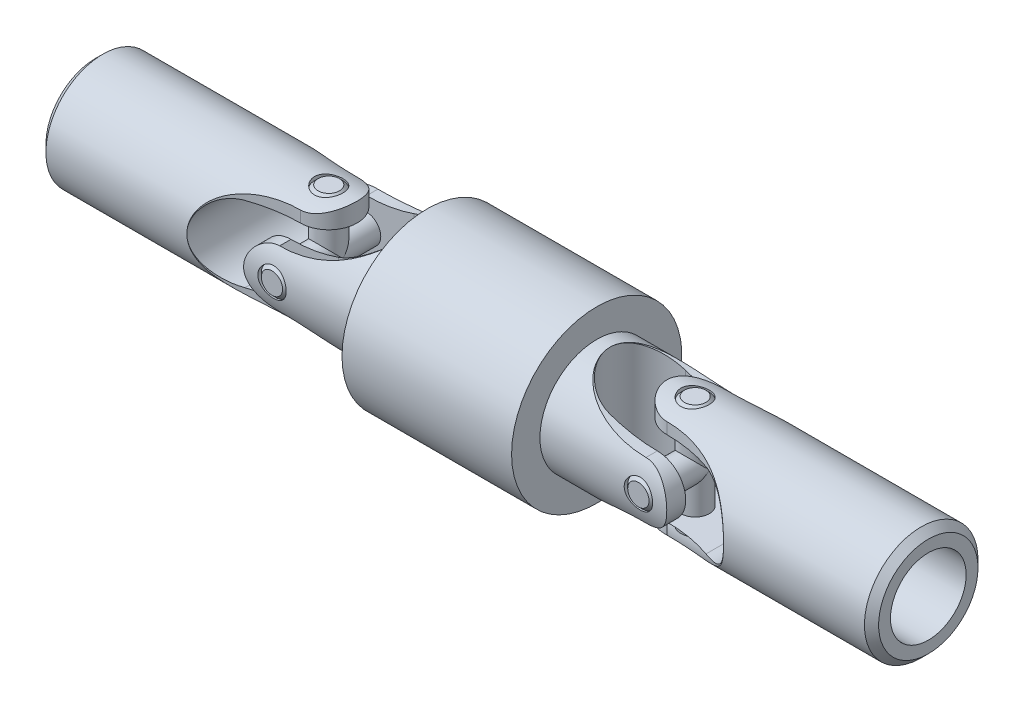
from build123d import *

# Parameters (mm, degrees)
SKETCH1_W             = 21.93925
SKETCH1_H             = 4.7625
CHAMFER1_SIZE         = 0.595313
EXTRUDE1_DEPTH        = 19.716349
EXTRUDE1_DEPTH_BACK   = 19.716349
EXTRUDE3_DEPTH        = 19.716349
EXTRUDE3_DEPTH_BACK   = 19.716349
SKETCH4_R             = 3.175
EXTRUDE4_DEPTH        = 9.525
EXTRUDE6_DEPTH        = 19.716349
EXTRUDE6_DEPTH_BACK   = 19.716349
SKETCH6_R             = 1.190625
BODY_MOVE_COPY1_ANGLE = 90
SKETCH19_W            = 4.191
SKETCH19_H            = 9.525
CUT_EXTRUDE1_DEPTH    = 38.1
SKETCH14_R            = 1.190625
EXTRUDE14_DEPTH       = 4.7625
SKETCH16_R            = 1.190625
EXTRUDE16_DEPTH       = 4.7625
CHAMFER3_SIZE         = 0.297656
SKETCH20_R            = 7.14375
SKETCH20_R_2          = 4.7625
BOSS_EXTRUDE1_DEPTH   = 7.112


with BuildPart() as part:
    # Sketch1 → Revolve1 (revolve)
    with BuildSketch(Plane(origin=(0, 0, 0), x_dir=(1, 0, 0), z_dir=(0, 1, 0)), mode=Mode.PRIVATE) as revolve1_sk:
        with Locations((-6.492875, 2.38125)):
            Rectangle(SKETCH1_W, SKETCH1_H)
    revolve(revolve1_sk.sketch.rotate(Axis((-17.4625, 0, 0), (1, 0, 0)), 180), axis=Axis((-17.4625, 0, 0), (1, 0, 0)))

    # Chamfer1
    chamfer1_edges = [part.edges().sort_by_distance(p)[0] for p in [
        (-17.4625, 0, -4.7625),
    ]]
    chamfer(chamfer1_edges, length=CHAMFER1_SIZE)

    # Sketch2 → Extrude1 (cut, two sides: drawn at the far end of the back side and taken through both)
    with BuildSketch(Plane(origin=(0, 0, 0), x_dir=(1, 0, 0), z_dir=(0, 1, 0)).offset(-EXTRUDE1_DEPTH_BACK)):
        with BuildLine():
            Line((-5.04825, 4.7625), (6.858, 4.7625))
            Line((6.858, 4.7625), (6.858, -4.7625))
            Line((6.858, -4.7625), (-5.04825, -4.7625))
            ThreePointArc((-5.04825, -4.7625), (-1.669587, -2.992239), (2.0955, -2.38125))
            ThreePointArc((2.0955, -2.38125), (4.47675, 0), (2.0955, 2.38125))
            ThreePointArc((2.0955, 2.38125), (-1.669587, 2.992239), (-5.04825, 4.7625))
        make_face()
    extrude(amount=EXTRUDE1_DEPTH + EXTRUDE1_DEPTH_BACK, mode=Mode.SUBTRACT)

    # Sketch3 → Extrude3 (cut, two sides: drawn at the far end of the back side and taken through both)
    with BuildSketch(Plane.XY.offset(-EXTRUDE3_DEPTH_BACK)):
        with BuildLine():
            Line((-1.876425, 3.171825), (6.858, 3.171825))
            Line((6.858, 3.171825), (6.858, -3.171825))
            Line((6.858, -3.171825), (-1.876425, -3.171825))
            ThreePointArc((-1.876425, -3.171825), (-5.04825, 0), (-1.876425, 3.171825))
        make_face()
    extrude(amount=EXTRUDE3_DEPTH + EXTRUDE3_DEPTH_BACK, mode=Mode.SUBTRACT)

    # Sketch4 → Extrude4 (cut)
    with BuildSketch(Plane.ZY.offset(17.4625)):
        Circle(SKETCH4_R)
    extrude(amount=-EXTRUDE4_DEPTH, mode=Mode.SUBTRACT)

    # Sketch6 → Extrude6 (cut, two sides: drawn at the far end of the back side and taken through both)
    with BuildSketch(Plane(origin=(0, 0, 0), x_dir=(1, 0, 0), z_dir=(0, 1, 0)).offset(-EXTRUDE6_DEPTH_BACK)):
        with Locations(Location((2.0955, 0, 0), (0, 0, 270))):
            Circle(SKETCH6_R)
    extrude(amount=EXTRUDE6_DEPTH + EXTRUDE6_DEPTH_BACK, mode=Mode.SUBTRACT)


with BuildPart() as body_2:
    # Mirror1: mirrored copy
    add(part.part.mirror(Plane(origin=(2.0955, 0, 0), x_dir=(0, 0, 1), z_dir=(1, 0, 0))))


with BuildPart() as body_2_1:
    # Body-Move/Copy1: moved
    add(body_2.part.rotate(Axis((0, 0, 0), (1, 0, 0)), BODY_MOVE_COPY1_ANGLE))

    # Sketch19 → Cut-Extrude1 (cut, symmetric)
    with BuildSketch(Plane(origin=(0, 0, 0), x_dir=(1, 0, 0), z_dir=(0, 1, 0))):
        with Locations((19.558, 0)):
            Rectangle(SKETCH19_W, SKETCH19_H)
    extrude(amount=CUT_EXTRUDE1_DEPTH, both=True, mode=Mode.SUBTRACT)


with BuildPart() as body_3:
    # Sketch14 → Extrude14 (new, symmetric)
    with BuildSketch(Plane(origin=(0, 0, 0), x_dir=(1, 0, 0), z_dir=(0, 1, 0))):
        with Locations(Location((2.0955, 0, 0), (0, 0, 90))):
            Circle(SKETCH14_R)
    extrude(amount=EXTRUDE14_DEPTH, both=True)

    # Sketch16 → Extrude16 (add, symmetric)
    with BuildSketch(Plane.XY):
        with Locations((2.0955, 0)):
            Circle(SKETCH16_R)
    extrude(amount=EXTRUDE16_DEPTH, both=True)

    # Chamfer3
    chamfer3_edges = [body_3.edges().sort_by_distance(p)[0] for p in [
        (2.0955, -4.7625, 1.190625),
        (2.0955, 4.7625, 1.190625),
        (0.904875, 0, -4.7625),
        (0.904875, 0, 4.7625),
    ]]
    chamfer(chamfer3_edges, length=CHAMFER3_SIZE)


with BuildPart() as body_4:
    # Mirror3: mirrored copy
    add(body_3.part.mirror(Plane(origin=(17.4625, -38.1, 4.7625), x_dir=(0, 0, 1), z_dir=(-1, 0, 0))))


with BuildPart() as body_5:
    # Mirror3 2: mirrored copy
    add(part.part.mirror(Plane(origin=(17.4625, -38.1, 4.7625), x_dir=(0, 0, 1), z_dir=(-1, 0, 0))))


with BuildPart() as body_6:
    # Mirror3 3: mirrored copy
    add(body_2_1.part.mirror(Plane(origin=(17.4625, -38.1, 4.7625), x_dir=(0, 0, 1), z_dir=(-1, 0, 0))))


with BuildPart() as body_7:
    # Sketch20 → Boss-Extrude1 (new, symmetric)
    with BuildSketch(Plane(origin=(17.4625, 0, 0), x_dir=(0, 0, -1), z_dir=(1, 0, 0))):
        with Locations(Location((0, 0, 0), (0, 0, 180))):
            Circle(SKETCH20_R)
        with Locations(Location((0, 0, 0), (0, 0, 180))):
            Circle(SKETCH20_R_2, mode=Mode.SUBTRACT)
    extrude(amount=BOSS_EXTRUDE1_DEPTH, both=True)


solid = Compound([part.part, body_2_1.part, body_3.part, body_4.part, body_5.part, body_6.part, body_7.part])
